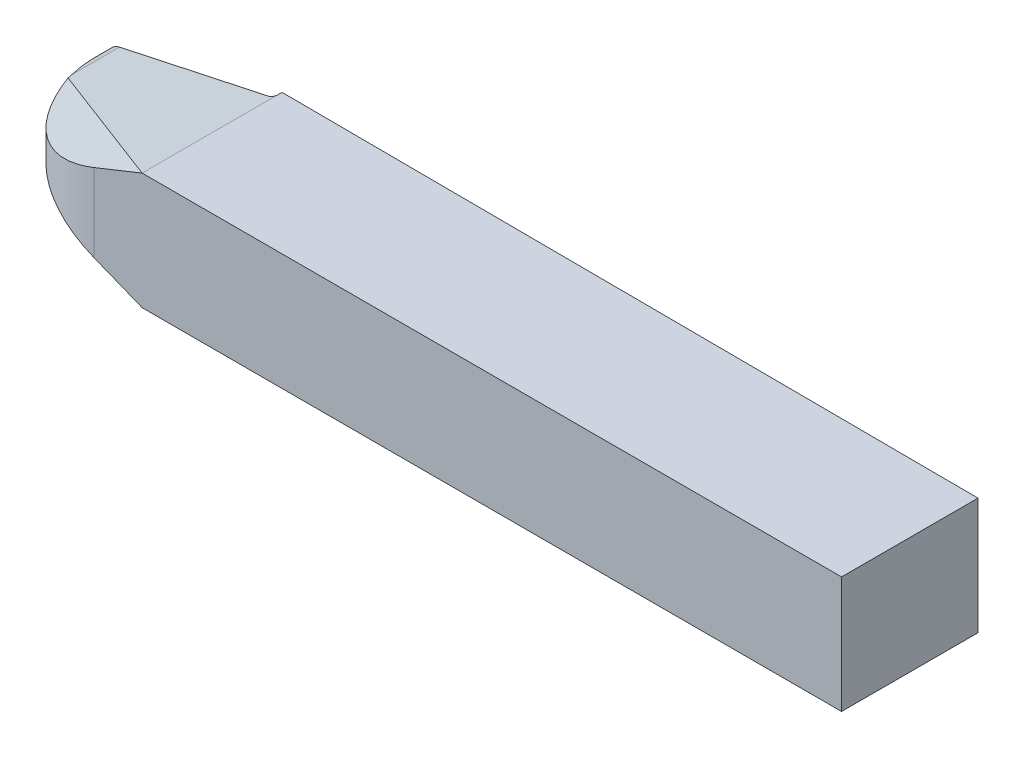
from build123d import *

# Parameters (mm, degrees)
EXTRUDE_1_DEPTH     = 24
SKETCH_2_OUTSIDE_W  = 182.644
SKETCH_2_OUTSIDE_H  = 56.644
CUT_EXTRUDE_1_DEPTH = 24
SKETCH_6_W          = 43.637196822
SKETCH_6_H          = 35.300538325
CUT_EXTRUDE_2_DEPTH = 24


with BuildPart() as part:
    # Эскиз1 → Бобышка-Вытянуть1 (new body)
    with BuildSketch(Plane.XY):
        with BuildLine():
            Line((0, 0), (120, 0))
            Line((120, 0), (120, 20))
            Line((120, 20), (0, 20))
            Line((0, 20), (-27.743147483, 12.906498205))
            ThreePointArc((-27.743147483, 12.906498205), (-30, 10), (-27.743147483, 7.093501795))
            Line((-27.743147483, 7.093501795), (0, 0))
        make_face()
    extrude(amount=EXTRUDE_1_DEPTH)

    # Эскиз2 outside → Вырез-Вытянуть1 (cut)
    with BuildSketch(Plane(origin=(0, 0, 0), x_dir=(1, 0, 0), z_dir=(0, 1, 0))):
        with Locations((45, -12)):
            Rectangle(SKETCH_2_OUTSIDE_W, SKETCH_2_OUTSIDE_H)
        with BuildLine():
            Line((-30, 0), (-27.541196148, -9.176380902))
            ThreePointArc((-27.541196148, -9.176380902), (-20.397908202, -19.867066806), (-8.222679622, -24))
            Line((-8.222679622, -24), (0, -24))
            Line((0, -24), (155.035600822, -24))
            Line((155.035600822, -24), (155.035600822, -0.765531499))
            Line((155.035600822, -0.765531499), (0, 0))
            Line((0, 0), (0, -0.765531499))
            ThreePointArc((0, -0.765531499), (-0.238574389, -1.320828429), (-0.805596322, -1.530013864))
            Line((-0.805596322, -1.530013864), (-30, 0))
        make_face(mode=Mode.SUBTRACT)
    extrude(amount=CUT_EXTRUDE_1_DEPTH, mode=Mode.SUBTRACT)

    # Эскиз6 → Вырез-Вытянуть2 (cut)
    with BuildSketch(Plane(origin=(-8.581317892, 21.458428849, 5.749768681), x_dir=(0.9328250222338894, 0.34805174336163447, 0.09326018355799502), z_dir=(-0.36032967945250355, 0.9010397803843876, 0.24143288150231465))):
        with Locations((-5.019191461, -7.289608273)):
            Rectangle(SKETCH_6_W, SKETCH_6_H)
    cut_extrude_2 = extrude(amount=CUT_EXTRUDE_2_DEPTH, mode=Mode.SUBTRACT)

    # Зеркальное отражение1: Вырез-Вытянуть2 across plane
    add(cut_extrude_2.mirror(Plane(origin=(0, 10, 0), x_dir=(0, 0, 1), z_dir=(0, -1, 0))), mode=Mode.SUBTRACT)


solid = part.part
